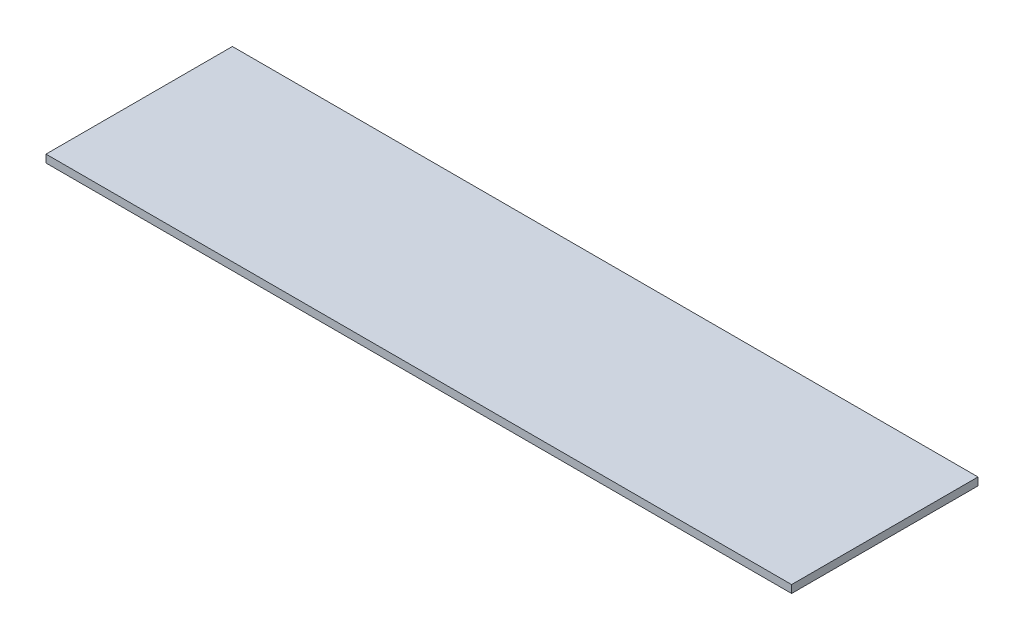
from build123d import *

# Parameters (mm, degrees)
SKETCH1_W           = 609.6
SKETCH1_H           = 152.4
BOSS_EXTRUDE1_DEPTH = 3.175


with BuildPart() as part:
    # Sketch1 → Boss-Extrude1 (new, symmetric)
    with BuildSketch(Plane(origin=(0, 0, 0), x_dir=(1, 0, 0), z_dir=(0, 1, 0))):
        Rectangle(SKETCH1_W, SKETCH1_H)
    extrude(amount=BOSS_EXTRUDE1_DEPTH, both=True)


solid = part.part
